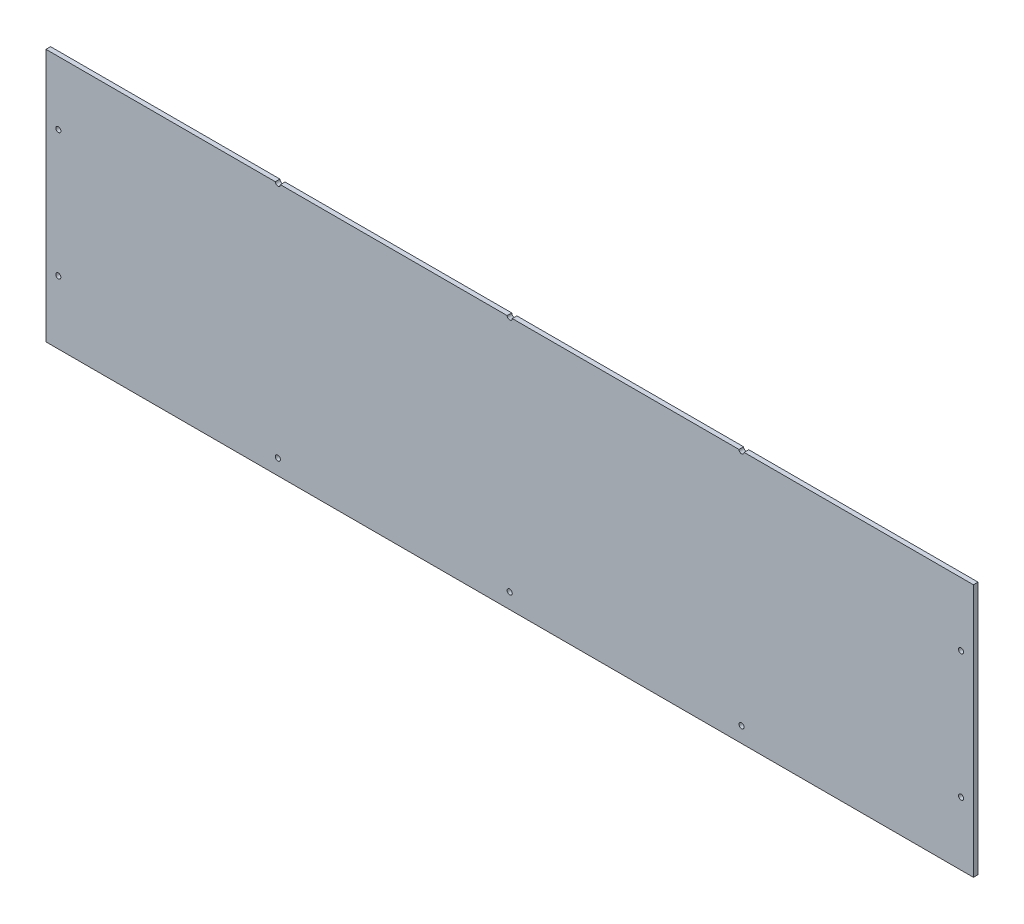
from build123d import *

# Parameters (mm, degrees)
SKETCH1_R           = 2.5
BOSS_EXTRUDE1_DEPTH = 4.5


with BuildPart() as part:
    # Sketch1 → Boss-Extrude1 (new body)
    with BuildSketch(Plane.XY):
        with BuildLine():
            Line((-452, 123.5), (-452, -123.5))
            Line((-452, -123.5), (452, -123.5))
            Line((452, -123.5), (452, 123.5))
            Line((452, 123.5), (228.5, 123.5))
            ThreePointArc((228.5, 123.5), (226, 121), (223.5, 123.5))
            Line((223.5, 123.5), (2.5, 123.5))
            ThreePointArc((2.5, 123.5), (0, 121), (-2.5, 123.5))
            Line((-2.5, 123.5), (-223.5, 123.5))
            ThreePointArc((-223.5, 123.5), (-226, 121), (-228.5, 123.5))
            Line((-228.5, 123.5), (-452, 123.5))
        make_face()
        with Locations((-440, 61.75)):
            Circle(SKETCH1_R, mode=Mode.SUBTRACT)
        with Locations((-440, -61.75)):
            Circle(SKETCH1_R, mode=Mode.SUBTRACT)
        with Locations(Location((440, -61.75, 0), (0, 0, 180))):
            Circle(SKETCH1_R, mode=Mode.SUBTRACT)
        with Locations(Location((440, 61.75, 0), (0, 0, 180))):
            Circle(SKETCH1_R, mode=Mode.SUBTRACT)
        with Locations((0, -108.5)):
            Circle(SKETCH1_R, mode=Mode.SUBTRACT)
        with Locations((226, -108.5)):
            Circle(SKETCH1_R, mode=Mode.SUBTRACT)
        with Locations((-226, -108.5)):
            Circle(SKETCH1_R, mode=Mode.SUBTRACT)
    extrude(amount=BOSS_EXTRUDE1_DEPTH)


solid = part.part
